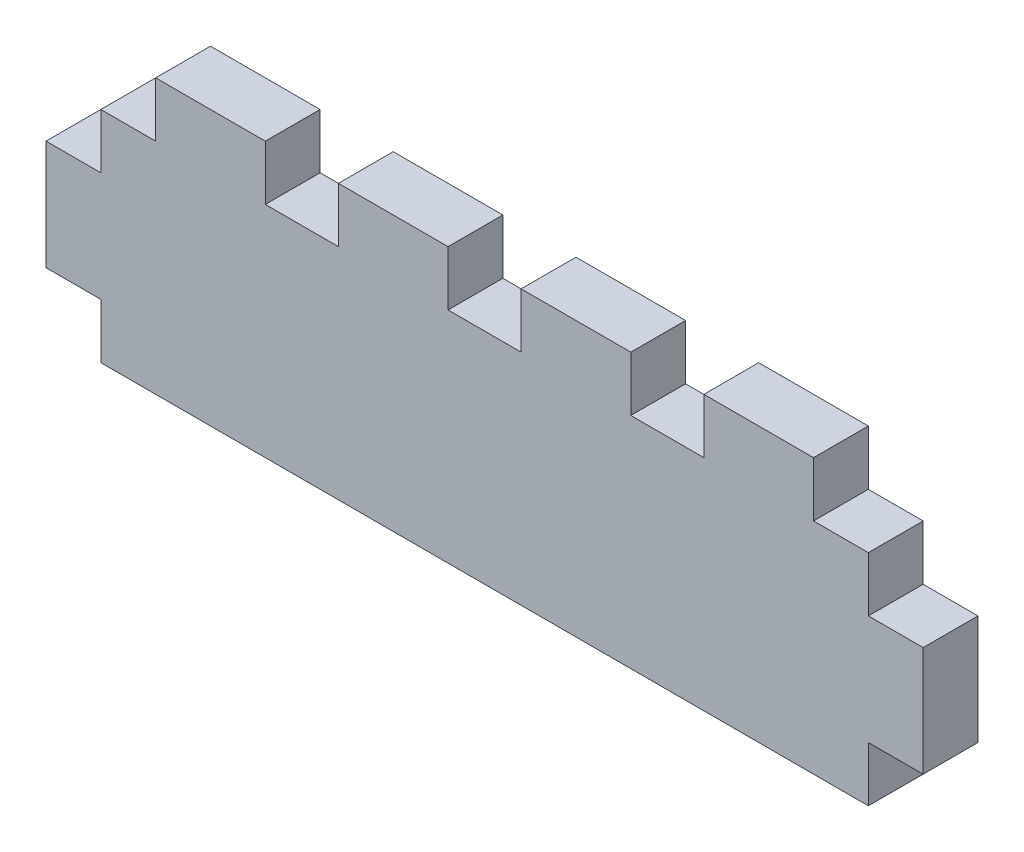
from build123d import *

# Parameters (mm, degrees)
SKETCH1_W           = 177.8
SKETCH1_H           = 50.8
BOSS_EXTRUDE1_DEPTH = 12.7
SKETCH2_W           = 25.4
SKETCH2_H           = 12.7
SKETCH2_W_2         = 12.7
SKETCH2_H_2         = 25.4
BOSS_EXTRUDE2_DEPTH = 12.7


with BuildPart() as part:
    # Sketch1 → Boss-Extrude1 (new body)
    with BuildSketch(Plane.XY):
        with Locations((-88.9, 25.4)):
            Rectangle(SKETCH1_W, SKETCH1_H)
    extrude(amount=BOSS_EXTRUDE1_DEPTH)

    # Sketch2 → Boss-Extrude2 (add, through all)
    with BuildSketch(Plane.XY.offset(12.7)):
        with Locations((-152.4, 57.15)):
            Rectangle(SKETCH2_W, SKETCH2_H)
        with Locations((-110.066666667, 57.15)):
            Rectangle(SKETCH2_W, SKETCH2_H)
        with Locations((-67.733333333, 57.15)):
            Rectangle(SKETCH2_W, SKETCH2_H)
        with Locations((-25.4, 57.15)):
            Rectangle(SKETCH2_W, SKETCH2_H)
        with Locations((6.35, 25.4)):
            Rectangle(SKETCH2_W_2, SKETCH2_H_2)
        with Locations((-184.15, 25.4)):
            Rectangle(SKETCH2_W_2, SKETCH2_H_2)
    extrude(amount=-BOSS_EXTRUDE2_DEPTH)


solid = part.part
